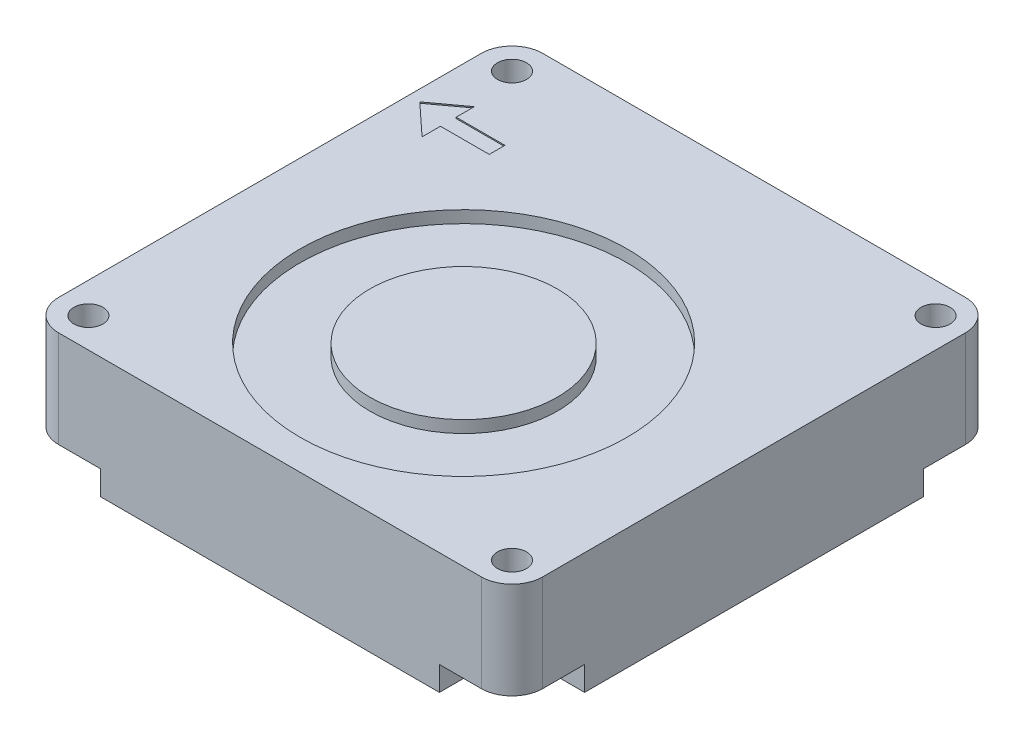
from build123d import *

# Parameters (mm, degrees)
SKETCH1_R           = 1.2
BOSS_EXTRUDE1_DEPTH = 10
SKETCH3_R           = 13.5
SKETCH3_R_2         = 7.75
CUT_EXTRUDE1_DEPTH  = 1
SKETCH4_W           = 28.3
SKETCH4_H           = 8.75
CUT_EXTRUDE2_DEPTH  = 6.444
CUT_EXTRUDE3_DEPTH  = 0.1
CUT_EXTRUDE4_DEPTH  = 2


with BuildPart() as part:
    # Sketch1 → Boss-Extrude1 (new body)
    with BuildSketch(Plane(origin=(0, 0, 0), x_dir=(1, 0, 0), z_dir=(0, 1, 0))):
        with BuildLine():
            Line((-13.613846154, 16.730769231), (21.306153846, 16.730769231))
            ThreePointArc((21.306153846, 16.730769231), (23.10220507, 15.986820455), (23.846153846, 14.190769231))
            Line((23.846153846, 14.190769231), (23.846153846, -20.729230769))
            ThreePointArc((23.846153846, -20.729230769), (23.10220507, -22.525281993), (21.306153846, -23.269230769))
            Line((21.306153846, -23.269230769), (-13.613846154, -23.269230769))
            ThreePointArc((-13.613846154, -23.269230769), (-15.409897378, -22.525281993), (-16.153846154, -20.729230769))
            Line((-16.153846154, -20.729230769), (-16.153846154, 14.190769231))
            ThreePointArc((-16.153846154, 14.190769231), (-15.409897378, 15.986820455), (-13.613846154, 16.730769231))
        make_face()
        with Locations(Location((-13.613846154, 14.190769231, 0), (0, 0, 270))):
            Circle(SKETCH1_R, mode=Mode.SUBTRACT)
        with Locations(Location((21.386153846, 14.190769231, 0), (0, 0, 270))):
            Circle(SKETCH1_R, mode=Mode.SUBTRACT)
        with Locations(Location((21.386153846, -20.809230769, 0), (0, 0, 270))):
            Circle(SKETCH1_R, mode=Mode.SUBTRACT)
        with Locations(Location((-13.613846154, -20.809230769, 0), (0, 0, 270))):
            Circle(SKETCH1_R, mode=Mode.SUBTRACT)
    extrude(amount=BOSS_EXTRUDE1_DEPTH)

    # Sketch3 → Cut-Extrude1 (cut)
    with BuildSketch(Plane(origin=(0, 10, 0), x_dir=(1, 0, 0), z_dir=(0, 1, 0))):
        with Locations(Location((3.846153846, -7.269230769, 0), (0, 0, 270))):
            Circle(SKETCH3_R)
        with Locations(Location((3.846153846, -7.269230769, 0), (0, 0, 270))):
            Circle(SKETCH3_R_2, mode=Mode.SUBTRACT)
    extrude(amount=-CUT_EXTRUDE1_DEPTH, mode=Mode.SUBTRACT)

    # Sketch4 → Cut-Extrude2 (cut)
    with BuildSketch(Plane.ZY.offset(16.153846154)):
        with Locations((3.419230769, 5.092214042)):
            Rectangle(SKETCH4_W, SKETCH4_H)
    extrude(amount=-CUT_EXTRUDE2_DEPTH, mode=Mode.SUBTRACT)

    # Sketch5 → Cut-Extrude3 (cut)
    with BuildSketch(Plane(origin=(0, 10, 0), x_dir=(1, 0, 0), z_dir=(0, 1, 0))):
        Polygon((-12.625840765, 10.092905938), (-12.625840765, 8.58923838), (-8.593277769, 8.58923838), (-8.593277769, 7.290616398), (-12.625840765, 7.290616398), (-12.625840765, 5.771945506), (-15.223084728, 8.179147228), align=None)
    extrude(amount=-CUT_EXTRUDE3_DEPTH, mode=Mode.SUBTRACT)

    # Sketch6 → Cut-Extrude4 (cut)
    with BuildSketch(Plane.XZ):
        with BuildLine():
            Line((-16.153846154, 17.269230769), (-13.201846154, 17.269230769))
            ThreePointArc((-13.201846154, 17.269230769), (-11.046584685, 18.1619693), (-10.153846154, 20.317230769))
            Line((-10.153846154, 20.317230769), (-10.153846154, 23.269230769))
            Line((-10.153846154, 23.269230769), (-10.153846154, 27.06129419))
            Line((-10.153846154, 27.06129419), (-21.305262053, 27.06129419))
            Line((-21.305262053, 27.06129419), (-21.305262053, 17.269230769))
            Line((-21.305262053, 17.269230769), (-16.153846154, 17.269230769))
        make_face()
        with BuildLine():
            Line((23.846153846, 17.269230769), (20.894153846, 17.269230769))
            ThreePointArc((20.894153846, 17.269230769), (18.738892377, 18.1619693), (17.846153846, 20.317230769))
            Line((17.846153846, 20.317230769), (17.846153846, 23.269230769))
            Line((17.846153846, 23.269230769), (17.846153846, 27.06129419))
            Line((17.846153846, 27.06129419), (26.668789671, 27.06129419))
            Line((26.668789671, 27.06129419), (26.668789671, 17.269230769))
            Line((26.668789671, 17.269230769), (23.846153846, 17.269230769))
        make_face()
        with BuildLine():
            Line((-10.153846154, -16.730769231), (-10.153846154, -13.778769231))
            ThreePointArc((-10.153846154, -13.778769231), (-11.046584685, -11.623507762), (-13.201846154, -10.730769231))
            Line((-13.201846154, -10.730769231), (-16.153846154, -10.730769231))
            Line((-16.153846154, -10.730769231), (-21.305262053, -10.730769231))
            Line((-21.305262053, -10.730769231), (-21.305262053, -18.817505275))
            Line((-21.305262053, -18.817505275), (-10.153846154, -18.817505275))
            Line((-10.153846154, -18.817505275), (-10.153846154, -16.730769231))
        make_face()
        with BuildLine():
            Line((17.846153846, -16.730769231), (17.846153846, -13.778769231))
            ThreePointArc((17.846153846, -13.778769231), (18.738892377, -11.623507762), (20.894153846, -10.730769231))
            Line((20.894153846, -10.730769231), (23.846153846, -10.730769231))
            Line((23.846153846, -10.730769231), (26.668789671, -10.730769231))
            Line((26.668789671, -10.730769231), (26.668789671, -18.817505275))
            Line((26.668789671, -18.817505275), (17.846153846, -18.817505275))
            Line((17.846153846, -18.817505275), (17.846153846, -16.730769231))
        make_face()
    extrude(amount=-CUT_EXTRUDE4_DEPTH, mode=Mode.SUBTRACT)


solid = part.part
